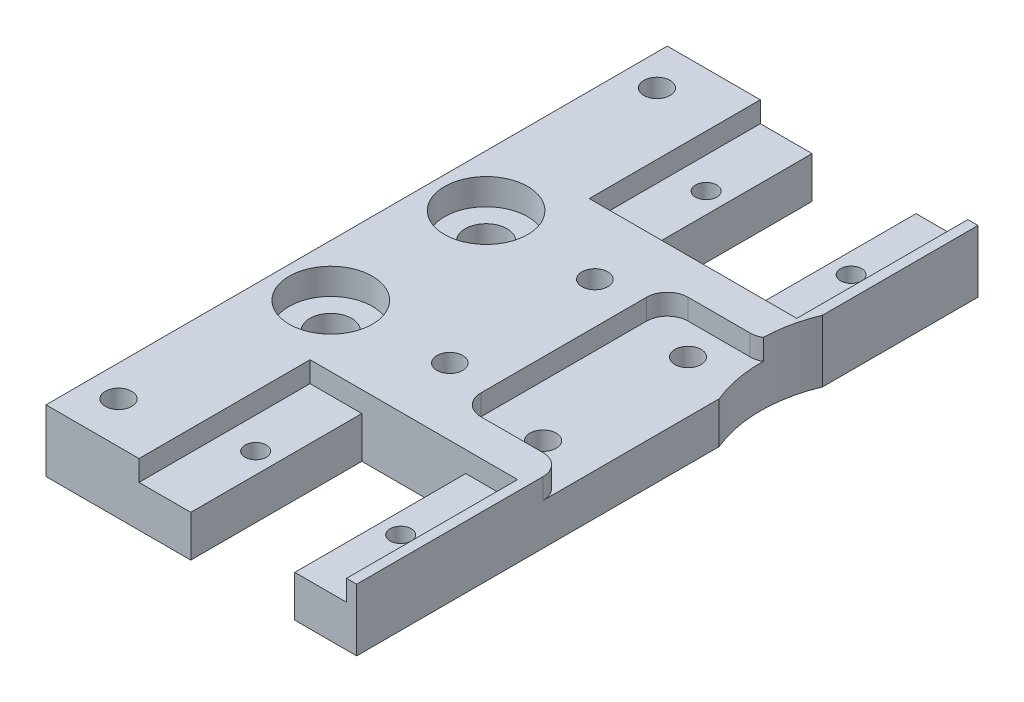
from build123d import *
from build123d.topology import SkipClean

# Parameters (mm, degrees)
EXTRUDE_1_DEPTH           = 2
EXTRUDE_2_DEPTH           = 3
SKETCH_3_W                = 16
SKETCH_3_H                = 60
EXTRUDE_3_DEPTH           = 3
CUT_EXTRUDE_1_DEPTH       = 1
SKETCH_4_W                = 10
SKETCH_4_H                = 16.5
CUT_EXTRUDE_2_DEPTH       = 69.543781629
SKETCH_6_W                = 20
SKETCH_6_H                = 16.5
CUT_EXTRUDE_4_DEPTH       = 2
SKETCH_7_R                = 1
SKETCH_7_R_2              = 4
CUT_EXTRUDE_5_DEPTH       = 3.5
SKETCH_10_R               = 4
EXTRUDE_5_DEPTH           = 2
SKETCH_11_R               = 3
CUT_EXTRUDE_6_DEPTH       = 2.5
SKETCH_12_R               = 1.75
CUT_EXTRUDE_7_DEPTH       = 2.5
SKETCH_14_R               = 1.5
CUT_EXTRUDE_8_DEPTH       = 69.543781629
SKETCH_15_R               = 1.25
CUT_EXTRUDE_9_DEPTH       = 10
SKETCH_16_R               = 1.25
CUT_EXTRUDE_10_DEPTH      = 10
SKETCH_18_W               = 10.5
SKETCH_18_H               = 30
SKETCH_18_R               = 1.5
EXTRUDE_6_DEPTH           = 2
SKETCH_19_R               = 1.75
CUT_EXTRUDE_11_DEPTH      = 5
SKETCH_20_R               = 0.9
CUT_EXTRUDE_12_DEPTH      = 69.609401688
SKETCH_22_R               = 1.75
CUT_EXTRUDE_13_DEPTH      = 5
SKETCH_23_R               = 0.9
CUT_EXTRUDE_14_DEPTH      = 69.609401688
FILLET_1_R                = 2
FILLET_2_R                = 2
EXTRUDE_7_DEPTH           = 4
SKETCH_25_R               = 1.25
CUT_EXTRUDE_15_DEPTH      = 10
SKETCH_26_W               = 20.04
SKETCH_26_H               = 16.52
CUT_EXTRUDE_16_DEPTH      = 2
SKETCH_27_W               = 10.04
SKETCH_27_H               = 16.52
CUT_EXTRUDE_17_DEPTH      = 2
CUT_EXTRUDE_18_DEPTH      = 69.689518851
CUT_EXTRUDE_18_DEPTH_BACK = 69.689518851
SKETCH_28_R               = 1.02
SKETCH_28_R_2             = 0.92
SKETCH_28_R_3             = 1.27
SKETCH_30_R               = 1.575129029
SKETCH_30_R_2             = 1.931102163
SKETCH_30_R_3             = 1.716101448
SKETCH_30_R_4             = 1.816571349
EXTRUDE_8_DEPTH           = 2
HOLE_WIZARD_M2_5_1_D      = 2.05
SKETCH_33_R               = 3.02
CUT_EXTRUDE_19_DEPTH      = 2.53
EXTRUDE_START             = 3.5
SKETCH_35_R               = 1.5
EXTRUDE_9_DEPTH           = 3.5
SKETCH_36_R               = 4.02
CUT_EXTRUDE_21_DEPTH      = 2.53
EXTRUDE_START_2           = 0.47
SKETCH_37_R               = 1.75
SKETCH_37_R_2             = 0.92
EXTRUDE_10_DEPTH          = 0.47
CUT_EXTRUDE_22_DEPTH      = 69.514895461
CUT_EXTRUDE_22_DEPTH_BACK = 69.514895461
SKETCH_38_R               = 2.02
CUT_EXTRUDE_23_DEPTH      = 69.543781629
CUT_EXTRUDE_23_DEPTH_BACK = 69.543781629
SKETCH_39_W               = 32.485674915
SKETCH_39_H               = 61.831136529
CUT_EXTRUDE_24_DEPTH      = 44.324358045
CUT_EXTRUDE_24_DEPTH_BACK = 10
SKETCH_40_W               = 20
SKETCH_40_H               = 4
EXTRUDE_START_3           = 2
SKETCH_41_R               = 1.27
SKETCH_41_R_2             = 1.025
SKETCH_41_R_3             = 1.25
EXTRUDE_11_DEPTH          = 2
FILLET_4_R                = 2
SKETCH_42_R               = 1.27
CUT_EXTRUDE_25_DEPTH      = 10
SKETCH_43_W               = 1
SKETCH_43_H               = 60
CUT_EXTRUDE_26_DEPTH      = 10
SKETCH_44_R               = 13
CUT_EXTRUDE_27_DEPTH      = 10
EXTRUDE_START_4           = 4.53
SKETCH_45_R               = 1.75
EXTRUDE_12_DEPTH          = 6
SKETCH_46_R               = 4.02
CUT_EXTRUDE_28_DEPTH      = 2.53


with BuildPart() as part:
    # 草图1 → 凸台-拉伸1 (new body)
    with BuildSketch(Plane(origin=(0, 0, 0), x_dir=(1, 0, 0), z_dir=(0, 1, 0))):
        with BuildLine():
            Line((43, 1.5), (58.456841673, 3.534931811))
            ThreePointArc((58.456841673, 3.534931811), (61.401458892, 6.180320766), (59.995303837, 9.880534443))
            Line((59.995303837, 9.880534443), (31, 30))
            Line((31, 30), (10, 30))
            Line((10, 30), (0, 15))
            Line((0, 15), (0, -15))
            Line((0, -15), (10, -30))
            Line((10, -30), (31, -30))
            Line((31, -30), (59.995303837, -9.880534443))
            ThreePointArc((59.995303837, -9.880534443), (61.401458892, -6.180320766), (58.456841673, -3.534931811))
            Line((58.456841673, -3.534931811), (43, -1.5))
            Line((43, -1.5), (40, -1.5))
            Line((40, -1.5), (40, 1.5))
            Line((40, 1.5), (43, 1.5))
        make_face()
    extrude(amount=EXTRUDE_1_DEPTH)

    # 草图2 → 凸台-拉伸2 (add)
    with BuildSketch(Plane.XZ):
        Polygon((15, -30), (15, 30), (10, 30), (0, 15), (0, -15), (10, -30), align=None)
    extrude(amount=EXTRUDE_2_DEPTH)

    # 草图3 → 凸台-拉伸3 (add)
    with BuildSketch(Plane.XZ):
        with Locations((23, 0)):
            Rectangle(SKETCH_3_W, SKETCH_3_H)
    extrude(amount=EXTRUDE_3_DEPTH)

    # 草图5 → 切除-拉伸1 (cut)
    with BuildSketch(Plane.XZ.offset(3)):
        Polygon((10, -30), (31, -30), (31, 30), (10, 30), (0, 15), (0, -15), align=None)
    extrude(amount=-CUT_EXTRUDE_1_DEPTH, mode=Mode.SUBTRACT)

    # 草图4 → 切除-拉伸2 (cut, through all)
    with BuildSketch(Plane(origin=(0, 2, 0), x_dir=(1, 0, 0), z_dir=(0, 1, 0))):
        with Locations((20, -21.75)):
            Rectangle(SKETCH_4_W, SKETCH_4_H)
        with Locations((20, 21.75)):
            Rectangle(SKETCH_4_W, SKETCH_4_H)
    extrude(amount=-CUT_EXTRUDE_2_DEPTH, mode=Mode.SUBTRACT)

    # 草图6 → 切除-拉伸4 (cut)
    with BuildSketch(Plane(origin=(0, 2, 0), x_dir=(1, 0, 0), z_dir=(0, 1, 0))):
        with Locations((20, 21.75)):
            Rectangle(SKETCH_6_W, SKETCH_6_H)
        with Locations((20, -21.75)):
            Rectangle(SKETCH_6_W, SKETCH_6_H)
    extrude(amount=-CUT_EXTRUDE_4_DEPTH, mode=Mode.SUBTRACT)

    # 草图7 → 切除-拉伸5 (cut)
    with BuildSketch(Plane(origin=(0, 2, 0), x_dir=(1, 0, 0), z_dir=(0, 1, 0))):
        with Locations(Location((58, 7.004988826, 0), (0, 0, 270))):
            Circle(SKETCH_7_R)
        with Locations(Location((58, -7.004988826, 0), (0, 0, 270))):
            Circle(SKETCH_7_R)
        with Locations(Location((43, -6, 0), (0, 0, 270))):
            Circle(SKETCH_7_R)
        with Locations(Location((43, 6, 0), (0, 0, 270))):
            Circle(SKETCH_7_R)
        with Locations(Location((6, 7.5, 0), (0, 0, 270))):
            Circle(SKETCH_7_R_2)
        with Locations(Location((6, -7.5, 0), (0, 0, 270))):
            Circle(SKETCH_7_R_2)
    extrude(amount=-CUT_EXTRUDE_5_DEPTH, mode=Mode.SUBTRACT)

    # 草图10 → 凸台-拉伸5 (add)
    with BuildSketch(Plane.XZ):
        with Locations(Location((43, 6, 0), (0, 0, 270))):
            Circle(SKETCH_10_R)
    extrude(amount=EXTRUDE_5_DEPTH)

    # 草图11 → 切除-拉伸6 (cut)
    with BuildSketch(Plane(origin=(0, 2, 0), x_dir=(1, 0, 0), z_dir=(0, 1, 0))):
        with Locations(Location((43, -6, 0), (0, 0, 270))):
            Circle(SKETCH_11_R)
    extrude(amount=-CUT_EXTRUDE_6_DEPTH, mode=Mode.SUBTRACT)

    # 草图12 → 切除-拉伸7 (cut)
    with BuildSketch(Plane(origin=(0, -0.5, 0), x_dir=(1, 0, 0), z_dir=(0, 1, 0))):
        with Locations(Location((43, -6, 0), (0, 0, 270))):
            Circle(SKETCH_12_R)
    extrude(amount=-CUT_EXTRUDE_7_DEPTH, mode=Mode.SUBTRACT)

    # 草图14 → 切除-拉伸8 (cut, through all)
    with BuildSketch(Plane(origin=(0, 2, 0), x_dir=(1, 0, 0), z_dir=(0, 1, 0))):
        with Locations(Location((6, 7.5, 0), (0, 0, 270))):
            Circle(SKETCH_14_R)
        with Locations(Location((6, -7.5, 0), (0, 0, 270))):
            Circle(SKETCH_14_R)
    extrude(amount=-CUT_EXTRUDE_8_DEPTH, mode=Mode.SUBTRACT)

    # 草图15 → 切除-拉伸9 (cut)
    with BuildSketch(Plane(origin=(0, 0, 0), x_dir=(1, 0, 0), z_dir=(0, 1, 0))):
        with Locations(Location((13, 21.75, 0), (0, 0, 270))):
            Circle(SKETCH_15_R)
        with Locations(Location((27, 21.75, 0), (0, 0, 270))):
            Circle(SKETCH_15_R)
        with Locations(Location((27, -21.75, 0), (0, 0, 270))):
            Circle(SKETCH_15_R)
        with Locations(Location((13, -21.75, 0), (0, 0, 270))):
            Circle(SKETCH_15_R)
    extrude(amount=-CUT_EXTRUDE_9_DEPTH, mode=Mode.SUBTRACT)

    # 草图16 → 切除-拉伸10 (cut)
    with BuildSketch(Plane(origin=(0, 2, 0), x_dir=(1, 0, 0), z_dir=(0, 1, 0))):
        with Locations(Location((17, -7, 0), (0, 0, 270))):
            Circle(SKETCH_16_R)
        with Locations(Location((17, 7, 0), (0, 0, 270))):
            Circle(SKETCH_16_R)
        with Locations(Location((37, 16, 0), (0, 0, 270))):
            Circle(SKETCH_16_R)
        with Locations(Location((37, -16, 0), (0, 0, 270))):
            Circle(SKETCH_16_R)
    extrude(amount=-CUT_EXTRUDE_10_DEPTH, mode=Mode.SUBTRACT)

    # 草图18 → 凸台-拉伸6 (add)
    with BuildSketch(Plane.XZ.offset(2)):
        with Locations((5.25, 0)):
            Rectangle(SKETCH_18_W, SKETCH_18_H)
        with Locations(Location((6, 7.5, 0), (0, 0, 90))):
            Circle(SKETCH_18_R, mode=Mode.SUBTRACT)
        with Locations(Location((6, -7.5, 0), (0, 0, 90))):
            Circle(SKETCH_18_R, mode=Mode.SUBTRACT)
    extrude(amount=EXTRUDE_6_DEPTH)

    # 草图19 → 切除-拉伸11 (cut)
    with BuildSketch(Plane(origin=(0, 2, 0), x_dir=(1, 0, 0), z_dir=(0, 1, 0))):
        with Locations(Location((6, 12, 0), (0, 0, 270))):
            Circle(SKETCH_19_R)
        with Locations(Location((6, 3, 0), (0, 0, 270))):
            Circle(SKETCH_19_R)
    extrude(amount=-CUT_EXTRUDE_11_DEPTH, mode=Mode.SUBTRACT)

    # 草图20 → 切除-拉伸12 (cut, through all)
    with BuildSketch(Plane(origin=(0, -3, 0), x_dir=(1, 0, 0), z_dir=(0, 1, 0))):
        with Locations(Location((6, 12, 0), (0, 0, 270))):
            Circle(SKETCH_20_R)
        with Locations(Location((6, 3, 0), (0, 0, 270))):
            Circle(SKETCH_20_R)
    extrude(amount=-CUT_EXTRUDE_12_DEPTH, mode=Mode.SUBTRACT)

    # 草图22 → 切除-拉伸13 (cut)
    with BuildSketch(Plane(origin=(0, 2, 0), x_dir=(1, 0, 0), z_dir=(0, 1, 0))):
        with Locations(Location((6, -3, 0), (0, 0, 270))):
            Circle(SKETCH_22_R)
        with Locations(Location((6, -12, 0), (0, 0, 270))):
            Circle(SKETCH_22_R)
    extrude(amount=-CUT_EXTRUDE_13_DEPTH, mode=Mode.SUBTRACT)

    # 草图23 → 切除-拉伸14 (cut, through all)
    with BuildSketch(Plane(origin=(0, -3, 0), x_dir=(1, 0, 0), z_dir=(0, 1, 0))):
        with Locations(Location((6, -3, 0), (0, 0, 270))):
            Circle(SKETCH_23_R)
        with Locations(Location((6, -12, 0), (0, 0, 270))):
            Circle(SKETCH_23_R)
    extrude(amount=-CUT_EXTRUDE_14_DEPTH, mode=Mode.SUBTRACT)

    # 圆角1
    fillet_1_edges = [part.edges().sort_by_distance(p)[0] for p in [
        (10.5, -3, 15),
    ]]
    fillet(fillet_1_edges, radius=FILLET_1_R)

    # 圆角2
    fillet_2_edges = [part.edges().sort_by_distance(p)[0] for p in [
        (10.5, -3, -15),
    ]]
    fillet(fillet_2_edges, radius=FILLET_2_R)

    # 草图24 → 凸台-拉伸7 (add)
    with BuildSketch(Plane(origin=(0, 2, 0), x_dir=(1, 0, 0), z_dir=(0, 1, 0))):
        Polygon((10, 30), (0, 30), (0, 15), align=None)
        Polygon((0, -15), (0, -30), (10, -30), align=None)
    extrude(amount=-EXTRUDE_7_DEPTH)

    # 草图25 → 切除-拉伸15 (cut)
    with BuildSketch(Plane(origin=(0, 2, 0), x_dir=(1, 0, 0), z_dir=(0, 1, 0))):
        with Locations(Location((4, 26, 0), (0, 0, 270))):
            Circle(SKETCH_25_R)
        with Locations(Location((4, -26, 0), (0, 0, 270))):
            Circle(SKETCH_25_R)
    extrude(amount=-CUT_EXTRUDE_15_DEPTH, mode=Mode.SUBTRACT)

    # 草图26 → 切除-拉伸16 (cut)
    with BuildSketch(Plane(origin=(0, 2, 0), x_dir=(1, 0, 0), z_dir=(0, 1, 0))):
        with Locations((20, 21.74)):
            Rectangle(SKETCH_26_W, SKETCH_26_H)
        with Locations((20, -21.74)):
            Rectangle(SKETCH_26_W, SKETCH_26_H)
    extrude(amount=-CUT_EXTRUDE_16_DEPTH, mode=Mode.SUBTRACT)

    # 草图27 → 切除-拉伸17 (cut)
    with BuildSketch(Plane(origin=(0, 0, 0), x_dir=(1, 0, 0), z_dir=(0, 1, 0))):
        with Locations((20, 21.74)):
            Rectangle(SKETCH_27_W, SKETCH_27_H)
        with Locations((20, -21.74)):
            Rectangle(SKETCH_27_W, SKETCH_27_H)
    extrude(amount=-CUT_EXTRUDE_17_DEPTH, mode=Mode.SUBTRACT)

    # 草图28 → 切除-拉伸18 (cut, two sides: drawn at the far end of the back side and taken through both)
    with BuildSketch(Plane(origin=(0, 2, 0), x_dir=(1, 0, 0), z_dir=(0, 1, 0)).offset(-CUT_EXTRUDE_18_DEPTH_BACK)):
        with Locations(Location((43, 6, 0), (0, 0, 90))):
            Circle(SKETCH_28_R)
        with Locations(Location((58, 7.004988826, 0), (0, 0, 90))):
            Circle(SKETCH_28_R)
        with Locations(Location((58, -7.004988826, 0), (0, 0, 90))):
            Circle(SKETCH_28_R)
        with Locations(Location((6, 12, 0), (0, 0, 270))):
            Circle(SKETCH_28_R_2)
        with Locations(Location((6, 3, 0), (0, 0, 270))):
            Circle(SKETCH_28_R_2)
        with Locations(Location((6, -3, 0), (0, 0, 270))):
            Circle(SKETCH_28_R_2)
        with Locations(Location((6, -12, 0), (0, 0, 270))):
            Circle(SKETCH_28_R_2)
        with Locations(Location((4, 26, 0), (0, 0, 270))):
            Circle(SKETCH_28_R_3)
        with Locations(Location((4, -26, 0), (0, 0, 270))):
            Circle(SKETCH_28_R_3)
    extrude(amount=CUT_EXTRUDE_18_DEPTH + CUT_EXTRUDE_18_DEPTH_BACK, mode=Mode.SUBTRACT)

    # 草图30 → 凸台-拉伸8 (add)
    with BuildSketch(Plane(origin=(0, 0, 0), x_dir=(1, 0, 0), z_dir=(0, 1, 0))):
        with Locations((13, 21.75)):
            Circle(SKETCH_30_R)
        with Locations((27, 21.75)):
            Circle(SKETCH_30_R_2)
        with Locations((27, -21.75)):
            Circle(SKETCH_30_R_3)
        with Locations((13, -21.75)):
            Circle(SKETCH_30_R_4)
    extrude(amount=-EXTRUDE_8_DEPTH)

    # M2.5 螺纹孔1 (through all)
    with Locations(Plane(origin=(0, 0, 0), x_dir=(1, 0, 0), z_dir=(0, 1, 0))):
        with Locations((13, 21.75), (27, 21.75), (27, -21.75), (13, -21.75)):
            Hole(HOLE_WIZARD_M2_5_1_D / 2)

    # 草图33 → 切除-拉伸19 (cut)
    with BuildSketch(Plane(origin=(0, 2, 0), x_dir=(1, 0, 0), z_dir=(0, 1, 0))):
        with Locations(Location((43, -6, 0), (0, 0, 270))):
            Circle(SKETCH_33_R)
    extrude(amount=-CUT_EXTRUDE_19_DEPTH, mode=Mode.SUBTRACT)

    # 草图35 → 凸台-拉伸9 (add)
    # profile 1 of 2: a face of its own
    with SkipClean():  # the faces are left unmerged after this step: merging them gives an invalid solid
        with BuildSketch(Plane(origin=(0, -1.5, 0), x_dir=(1, 0, 0), z_dir=(0, 1, 0)).offset(EXTRUDE_START)):
            with BuildLine():
                ThreePointArc((4.450050404, -3.8125), (6, -4.75), (7.549949596, -3.8125))
                ThreePointArc((7.549949596, -3.8125), (10, -7.5), (7.549949596, -11.1875))
                ThreePointArc((7.549949596, -11.1875), (6, -10.25), (4.450050404, -11.1875))
                ThreePointArc((4.450050404, -11.1875), (2, -7.5), (4.450050404, -3.8125))
            make_face()
            with Locations(Location((6, -7.5, 0), (0, 0, 90))):
                Circle(SKETCH_35_R, mode=Mode.SUBTRACT)
        # profile 2 of 2: a face of its own
        with BuildSketch(Plane(origin=(0, -1.5, 0), x_dir=(1, 0, 0), z_dir=(0, 1, 0)).offset(EXTRUDE_START)):
            with BuildLine():
                ThreePointArc((4.450050404, 11.1875), (6, 10.25), (7.549949596, 11.1875))
                ThreePointArc((7.549949596, 11.1875), (10, 7.5), (7.549949596, 3.8125))
                ThreePointArc((7.549949596, 3.8125), (6, 4.75), (4.450050404, 3.8125))
                ThreePointArc((4.450050404, 3.8125), (2, 7.5), (4.450050404, 11.1875))
            make_face()
            with Locations(Location((6, 7.5, 0), (0, 0, 90))):
                Circle(SKETCH_35_R, mode=Mode.SUBTRACT)
        extrude(amount=-EXTRUDE_9_DEPTH)

    # 草图36 → 切除-拉伸21 (cut)
    with SkipClean():  # the faces are left unmerged after this step: merging them gives an invalid solid
        with BuildSketch(Plane(origin=(0, 2, 0), x_dir=(1, 0, 0), z_dir=(0, 1, 0))):
            with Locations((6, 7.5)):
                Circle(SKETCH_36_R)
            with Locations((6, -7.5)):
                Circle(SKETCH_36_R)
        extrude(amount=-CUT_EXTRUDE_21_DEPTH, mode=Mode.SUBTRACT)

    # 草图37 → 凸台-拉伸10 (add)
    # profile 1 of 4: a face of its own
    with SkipClean():  # the faces are left unmerged after this step: merging them gives an invalid solid
        with BuildSketch(Plane(origin=(0, -3, 0), x_dir=(1, 0, 0), z_dir=(0, 1, 0)).offset(EXTRUDE_START_2)):
            with Locations(Location((6, 12, 0), (0, 0, 270))):
                Circle(SKETCH_37_R)
            with Locations(Location((6, 12, 0), (0, 0, 270))):
                Circle(SKETCH_37_R_2, mode=Mode.SUBTRACT)
        # profile 2 of 4: a face of its own
        with BuildSketch(Plane(origin=(0, -3, 0), x_dir=(1, 0, 0), z_dir=(0, 1, 0)).offset(EXTRUDE_START_2)):
            with Locations(Location((6, 3, 0), (0, 0, 270))):
                Circle(SKETCH_37_R)
            with Locations(Location((6, 3, 0), (0, 0, 270))):
                Circle(SKETCH_37_R_2, mode=Mode.SUBTRACT)
        # profile 3 of 4: a face of its own
        with BuildSketch(Plane(origin=(0, -3, 0), x_dir=(1, 0, 0), z_dir=(0, 1, 0)).offset(EXTRUDE_START_2)):
            with Locations(Location((6, -3, 0), (0, 0, 270))):
                Circle(SKETCH_37_R)
            with Locations(Location((6, -3, 0), (0, 0, 270))):
                Circle(SKETCH_37_R_2, mode=Mode.SUBTRACT)
        # profile 4 of 4: a face of its own
        with BuildSketch(Plane(origin=(0, -3, 0), x_dir=(1, 0, 0), z_dir=(0, 1, 0)).offset(EXTRUDE_START_2)):
            with Locations(Location((6, -12, 0), (0, 0, 270))):
                Circle(SKETCH_37_R)
            with Locations(Location((6, -12, 0), (0, 0, 270))):
                Circle(SKETCH_37_R_2, mode=Mode.SUBTRACT)
        extrude(amount=-EXTRUDE_10_DEPTH)

    # 草图38 → 切除-拉伸22 (cut, two sides: drawn at the far end of the back side and taken through both)
    with BuildSketch(Plane(origin=(0, -0.53, 0), x_dir=(1, 0, 0), z_dir=(0, 1, 0)).offset(-CUT_EXTRUDE_22_DEPTH_BACK)):
        with Locations(Location((6, 7.5, 0), (0, 0, 270))):
            Circle(SKETCH_38_R)
        with Locations(Location((6, -7.5, 0), (0, 0, 270))):
            Circle(SKETCH_38_R)
    extrude(amount=CUT_EXTRUDE_22_DEPTH + CUT_EXTRUDE_22_DEPTH_BACK, mode=Mode.SUBTRACT)

    # 草图39 → 切除-拉伸23 (cut, two sides: drawn at the far end of the back side and taken through both)
    with BuildSketch(Plane.XZ.offset(-CUT_EXTRUDE_23_DEPTH_BACK)):
        with Locations((47.242837458, 0.915568264)):
            Rectangle(SKETCH_39_W, SKETCH_39_H)
    extrude(amount=CUT_EXTRUDE_23_DEPTH + CUT_EXTRUDE_23_DEPTH_BACK, mode=Mode.SUBTRACT)

    # 草图40 → 切除-拉伸24 (cut, two sides: drawn at the far end of the back side and taken through both)
    with BuildSketch(Plane(origin=(31, 0, 0), x_dir=(0, 0, -1), z_dir=(1, 0, 0)).offset(-CUT_EXTRUDE_24_DEPTH_BACK)):
        with Locations((0, 2)):
            Rectangle(SKETCH_40_W, SKETCH_40_H)
    extrude(amount=CUT_EXTRUDE_24_DEPTH + CUT_EXTRUDE_24_DEPTH_BACK, mode=Mode.SUBTRACT)

    # 草图41 → 凸台-拉伸11 (add)
    with BuildSketch(Plane.XZ.offset(2).offset(EXTRUDE_START_3)):
        with BuildLine():
            Line((31, 30), (25.02, 30))
            Line((25.02, 30), (25.02, 13.48))
            Line((25.02, 13.48), (14.98, 13.48))
            Line((14.98, 13.48), (14.98, 30))
            Line((14.98, 30), (0, 30))
            Line((0, 30), (0, 15))
            Line((0, 15), (8.5, 15))
            ThreePointArc((8.5, 15), (9.914213562, 14.414213562), (10.5, 13))
            Line((10.5, 13), (10.5, -13))
            ThreePointArc((10.5, -13), (9.914213562, -14.414213562), (8.5, -15))
            Line((8.5, -15), (0, -15))
            Line((0, -15), (0, -30))
            Line((0, -30), (14.98, -30))
            Line((14.98, -30), (14.98, -13.48))
            Line((14.98, -13.48), (25.02, -13.48))
            Line((25.02, -13.48), (25.02, -30))
            Line((25.02, -30), (31, -30))
            Line((31, -30), (31, 30))
        make_face()
        with Locations(Location((4, -26, 0), (0, 0, 90))):
            Circle(SKETCH_41_R, mode=Mode.SUBTRACT)
        with Locations(Location((13, -21.75, 0), (0, 0, 90))):
            Circle(SKETCH_41_R_2, mode=Mode.SUBTRACT)
        with Locations(Location((27, -21.75, 0), (0, 0, 90))):
            Circle(SKETCH_41_R_2, mode=Mode.SUBTRACT)
        with Locations(Location((17, -7, 0), (0, 0, 90))):
            Circle(SKETCH_41_R_3, mode=Mode.SUBTRACT)
        with Locations(Location((17, 7, 0), (0, 0, 90))):
            Circle(SKETCH_41_R_3, mode=Mode.SUBTRACT)
        with Locations(Location((27, 21.75, 0), (0, 0, 90))):
            Circle(SKETCH_41_R_2, mode=Mode.SUBTRACT)
        with Locations(Location((13, 21.75, 0), (0, 0, 90))):
            Circle(SKETCH_41_R_2, mode=Mode.SUBTRACT)
        with Locations(Location((4, 26, 0), (0, 0, 90))):
            Circle(SKETCH_41_R, mode=Mode.SUBTRACT)
    extrude(amount=-EXTRUDE_11_DEPTH)

    # 圆角4
    fillet_4_edges = [part.edges().sort_by_distance(p)[0] for p in [
        (31, 1, 10),
        (31, 1, -10),
        (21, 1, -10),
        (21, 1, 10),
    ]]
    fillet(fillet_4_edges, radius=FILLET_4_R)

    # 草图42 → 切除-拉伸25 (cut)
    with BuildSketch(Plane(origin=(0, 0, 0), x_dir=(1, 0, 0), z_dir=(0, 1, 0))):
        with Locations(Location((26, 7, 0), (0, 0, 270))):
            Circle(SKETCH_42_R)
        with Locations(Location((26, -7, 0), (0, 0, 270))):
            Circle(SKETCH_42_R)
    extrude(amount=-CUT_EXTRUDE_25_DEPTH, mode=Mode.SUBTRACT)

    # 草图43 → 切除-拉伸26 (cut)
    with BuildSketch(Plane(origin=(0, 2, 0), x_dir=(1, 0, 0), z_dir=(0, 1, 0))):
        with Locations((0.5, 0)):
            Rectangle(SKETCH_43_W, SKETCH_43_H)
    extrude(amount=-CUT_EXTRUDE_26_DEPTH, mode=Mode.SUBTRACT)

    # 草图44 → 切除-拉伸27 (cut)
    with BuildSketch(Plane.XZ.offset(4)):
        with Locations((43, -10)):
            Circle(SKETCH_44_R)
    extrude(amount=-CUT_EXTRUDE_27_DEPTH, mode=Mode.SUBTRACT)

    # 草图45 → 凸台-拉伸12 (add)
    with BuildSketch(Plane(origin=(0, -2.53, 0), x_dir=(1, 0, 0), z_dir=(0, 1, 0)).offset(EXTRUDE_START_4)):
        with Locations((6, 12)):
            Circle(SKETCH_45_R)
        with Locations((6, 3)):
            Circle(SKETCH_45_R)
        with Locations((6, -3)):
            Circle(SKETCH_45_R)
        with Locations((6, -12)):
            Circle(SKETCH_45_R)
    extrude(amount=-EXTRUDE_12_DEPTH)

    # 草图46 → 切除-拉伸28 (cut)
    with BuildSketch(Plane(origin=(0, 2, 0), x_dir=(1, 0, 0), z_dir=(0, 1, 0))):
        with Locations(Location((6, 7.5, 0), (0, 0, 270))):
            Circle(SKETCH_46_R)
        with Locations(Location((6, -7.5, 0), (0, 0, 270))):
            Circle(SKETCH_46_R)
    extrude(amount=-CUT_EXTRUDE_28_DEPTH, mode=Mode.SUBTRACT)


solid = part.part
